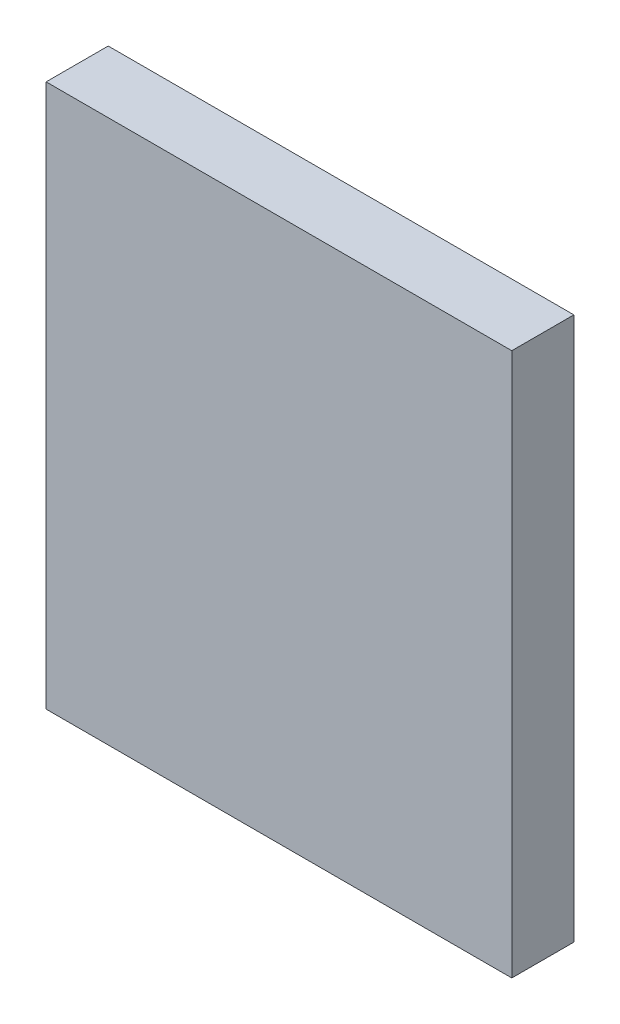
from build123d import *

# Parameters (mm, degrees)
SKETCH_1_W      = 30
SKETCH_1_H      = 35
EXTRUDE_1_DEPTH = 4


with BuildPart() as part:
    # 草图1 → 凸台-拉伸1 (new body)
    with BuildSketch(Plane.XY):
        Rectangle(SKETCH_1_W, SKETCH_1_H)
    extrude(amount=EXTRUDE_1_DEPTH)


solid = part.part
